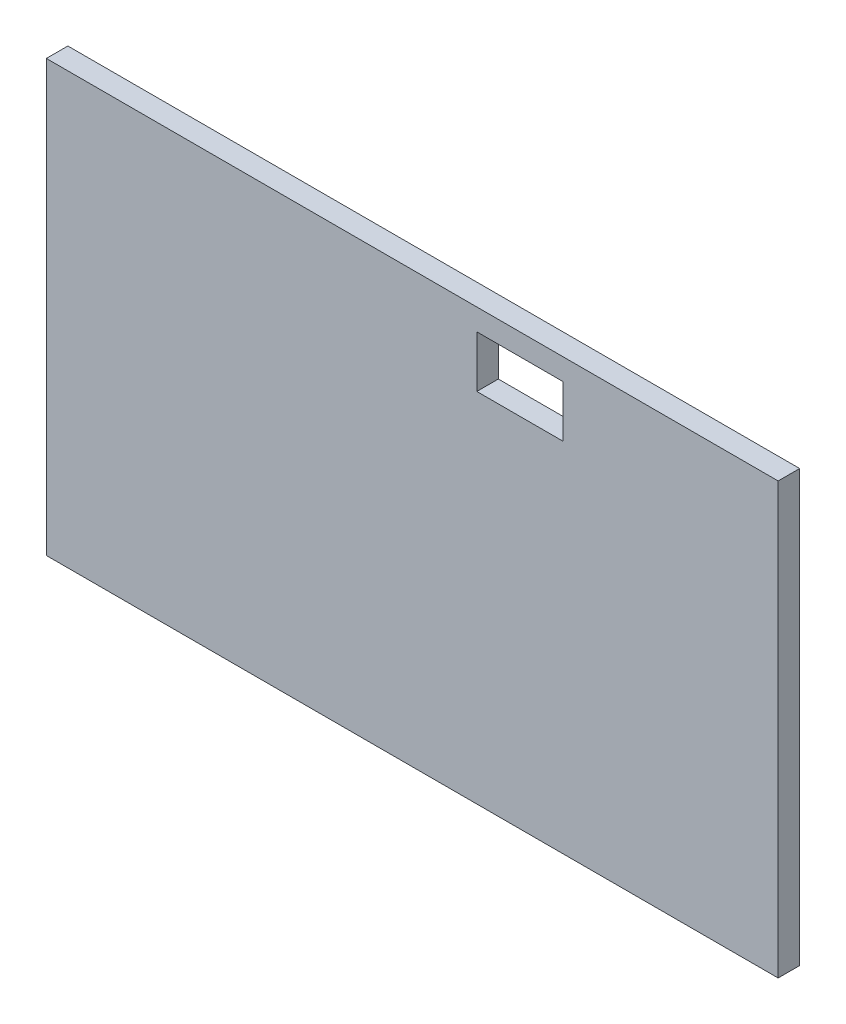
from build123d import *

# Parameters (mm, degrees)
SKETCH_1_W      = 170
SKETCH_1_H      = 100
SKETCH_1_W_2    = 20
SKETCH_1_H_2    = 12
EXTRUDE_1_DEPTH = 5


with BuildPart() as part:
    # Эскиз1 → Бобышка-Вытянуть1 (new body)
    with BuildSketch(Plane.XY):
        with Locations((85, 50)):
            Rectangle(SKETCH_1_W, SKETCH_1_H)
        with Locations((110, 89)):
            Rectangle(SKETCH_1_W_2, SKETCH_1_H_2, mode=Mode.SUBTRACT)
    extrude(amount=EXTRUDE_1_DEPTH)


solid = part.part
